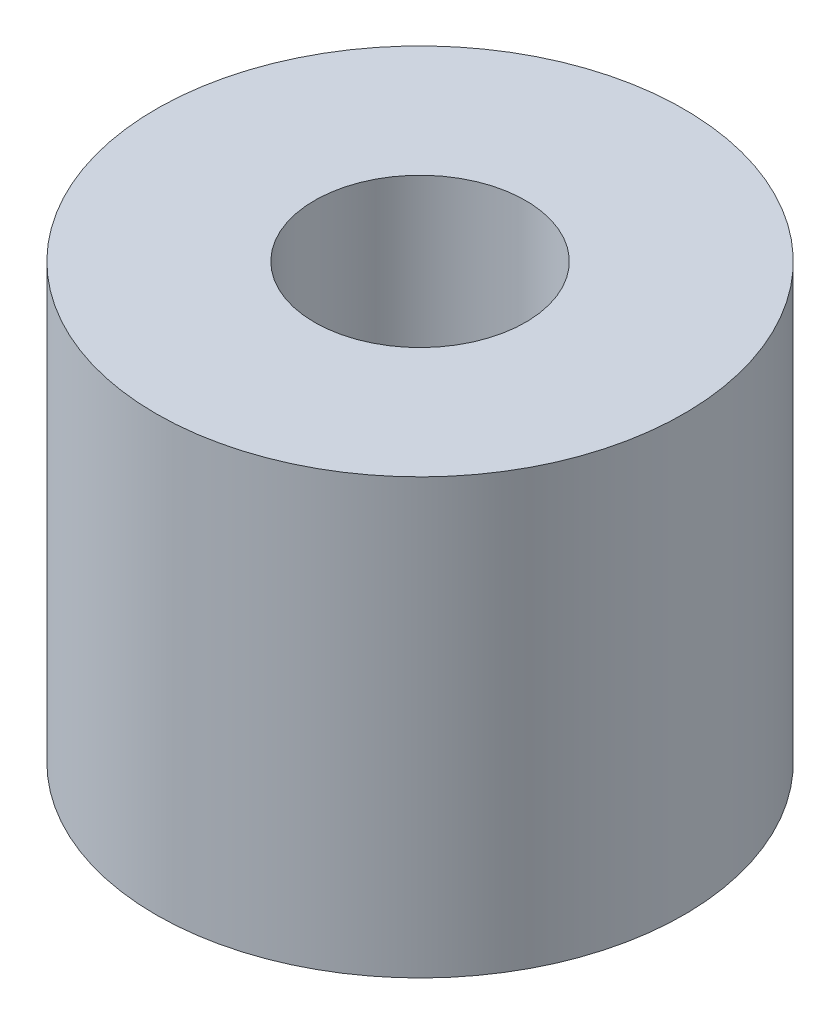
from build123d import *

# Parameters (mm, degrees)
CROQUIS1_R              = 2.25
CROQUIS1_R_2            = 0.9
SALIENTE_EXTRUIR1_DEPTH = 3.7


with BuildPart() as part:
    # Croquis1 → Saliente-Extruir1 (new body)
    with BuildSketch(Plane(origin=(0, 0, 0), x_dir=(1, 0, 0), z_dir=(0, 1, 0))):
        with Locations(Location((0, 0, 0), (0, 0, 270))):
            Circle(CROQUIS1_R)
        with Locations(Location((0, 0, 0), (0, 0, 270))):
            Circle(CROQUIS1_R_2, mode=Mode.SUBTRACT)
    extrude(amount=SALIENTE_EXTRUIR1_DEPTH)


solid = part.part
